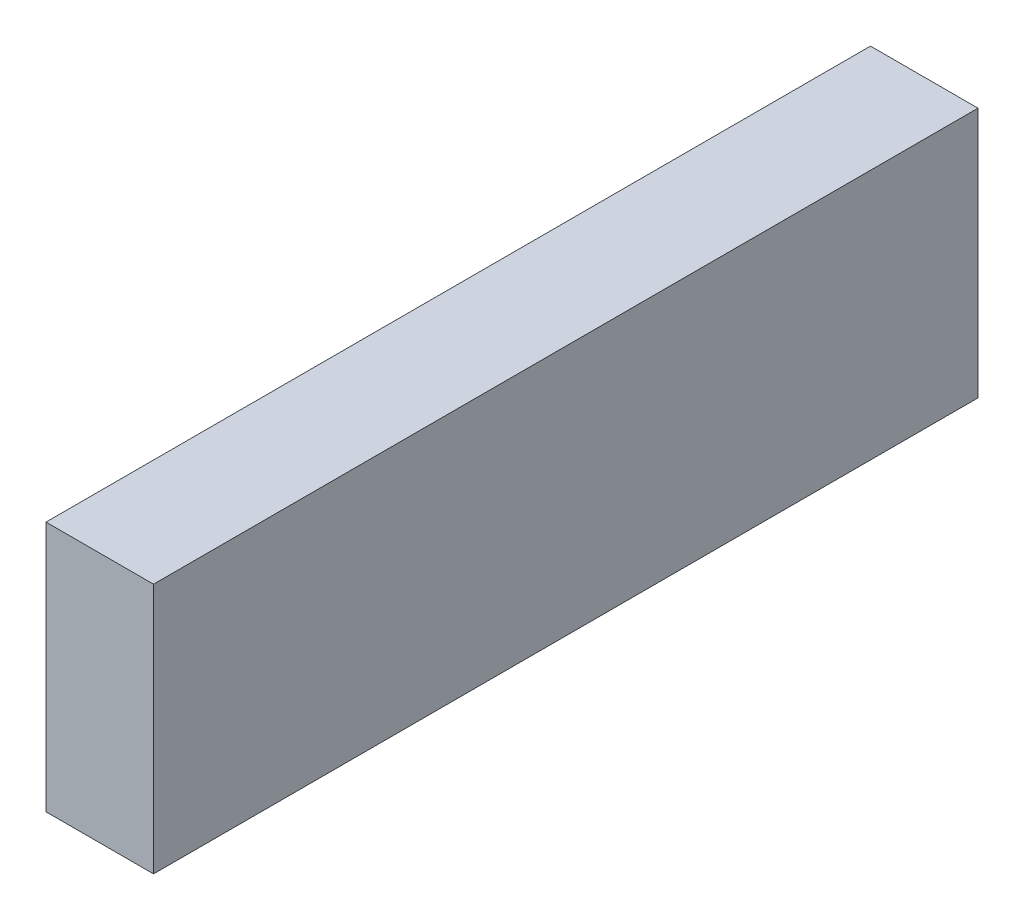
from build123d import *

# Parameters (mm, degrees)
SKETCH1_W           = 38.1
SKETCH1_H           = 88.9
BOSS_EXTRUDE1_DEPTH = 292.1


with BuildPart() as part:
    # Sketch1 → Boss-Extrude1 (new body)
    with BuildSketch(Plane.XY):
        with Locations((895.35, 1104.9)):
            Rectangle(SKETCH1_W, SKETCH1_H)
    extrude(amount=BOSS_EXTRUDE1_DEPTH)


solid = part.part
